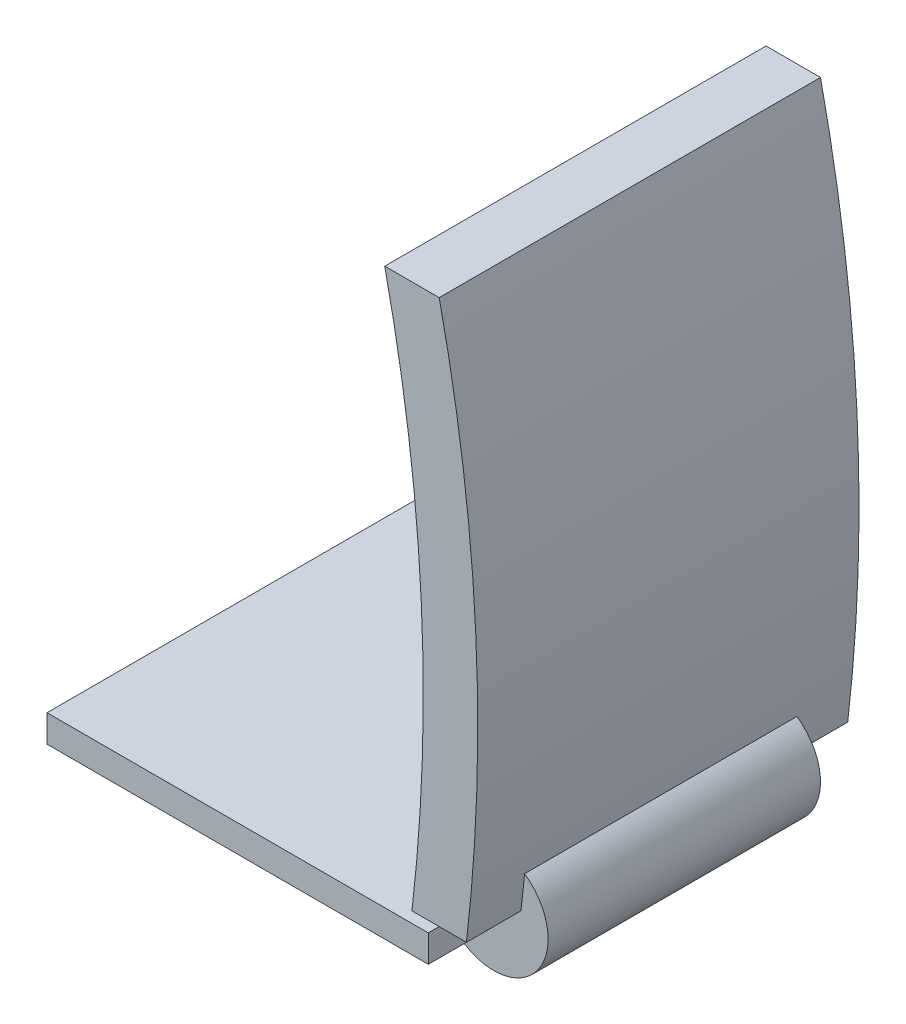
from build123d import *

# Parameters (mm, degrees)
BOSS_EXTRUDE1_DEPTH   = 350
SKETCH2_W             = 700
SKETCH2_H             = 50
BOSS_EXTRUDE1_2_DEPTH = 350
BOSS_EXTRUDE2_DEPTH   = 250
BOSS_EXTRUDE3_START   = 250
BOSS_EXTRUDE3_DEPTH   = 250
BOSS_EXTRUDE4_START   = 350
SKETCH2_5_W           = 700
SKETCH2_5_H           = 50
BOSS_EXTRUDE4_DEPTH   = 350
SKETCH3_R             = 100
CUT_EXTRUDE1_DEPTH    = 25


with BuildPart() as part:
    # Sketch2 → Boss-Extrude1 (new body)
    with BuildSketch(Plane.XY):
        with BuildLine():
            Line((-50, 20), (50, 20))
            ThreePointArc((50, 20), (67.013270812, 522.100663541), (0, 1020))
            Line((0, 1020), (-100, 1020))
            ThreePointArc((-100, 1020), (-32.986729188, 522.100663541), (-50, 20))
        make_face()
    extrude(amount=-BOSS_EXTRUDE1_DEPTH)



with BuildPart() as body_2:
    # Sketch2 → Boss-Extrude1 2 (new body)
    with BuildSketch(Plane.XY):
        with Locations((-370, -25)):
            Rectangle(SKETCH2_W, SKETCH2_H)
    extrude(amount=-BOSS_EXTRUDE1_2_DEPTH)


with BuildPart() as part_1:
    add(part.part)

    add(body_2.part)  # Boss-Extrude2 merges body 2
    # Sketch2<3> → Boss-Extrude2 (add)
    with BuildSketch(Plane.XY):
        with BuildLine():
            ThreePointArc((-86.602540378, -50), (67.847406367, -73.462435634), (56.713912861, 82.362200602))
            ThreePointArc((56.713912861, 82.362200602), (53.519940777, 51.163553411), (50, 20))
            Line((50, 20), (-50, 20))
            ThreePointArc((-50, 20), (-46.044408297, 55.236219759), (-42.505548953, 90.516729438))
            ThreePointArc((-42.505548953, 90.516729438), (-84.411358523, 53.616439199), (-100, 0))
            Line((-100, 0), (-20, 0))
            Line((-20, 0), (-20, -50))
            Line((-20, -50), (-86.602540378, -50))
        make_face()
    extrude(amount=-BOSS_EXTRUDE2_DEPTH)

    # Sketch2<4> → Boss-Extrude3 (add)
    with BuildSketch(Plane.XY.offset(BOSS_EXTRUDE3_START)):
        with BuildLine():
            ThreePointArc((-86.602540378, -50), (67.847406367, -73.462435634), (56.713912861, 82.362200602))
            ThreePointArc((56.713912861, 82.362200602), (53.519940777, 51.163553411), (50, 20))
            Line((50, 20), (-50, 20))
            ThreePointArc((-50, 20), (-46.044408297, 55.236219759), (-42.505548953, 90.516729438))
            ThreePointArc((-42.505548953, 90.516729438), (-84.411358523, 53.616439199), (-100, 0))
            Line((-100, 0), (-20, 0))
            Line((-20, 0), (-20, -50))
            Line((-20, -50), (-86.602540378, -50))
        make_face()
    extrude(amount=-BOSS_EXTRUDE3_DEPTH)

    # Sketch2<5> → Boss-Extrude4 (add)
    with BuildSketch(Plane.XY.offset(BOSS_EXTRUDE4_START)):
        with BuildLine():
            Line((-50, 20), (50, 20))
            ThreePointArc((50, 20), (67.013270812, 522.100663541), (0, 1020))
            Line((0, 1020), (-100, 1020))
            ThreePointArc((-100, 1020), (-32.986729188, 522.100663541), (-50, 20))
        make_face()
        with Locations((-370, -25)):
            Rectangle(SKETCH2_5_W, SKETCH2_5_H)
    extrude(amount=-BOSS_EXTRUDE4_DEPTH)

    # Sketch3 → Cut-Extrude1 (cut)
    with BuildSketch(Plane.XZ.offset(50)):
        with Locations((-370, 0)):
            Circle(SKETCH3_R)
    extrude(amount=-CUT_EXTRUDE1_DEPTH, mode=Mode.SUBTRACT)


solid = part_1.part
